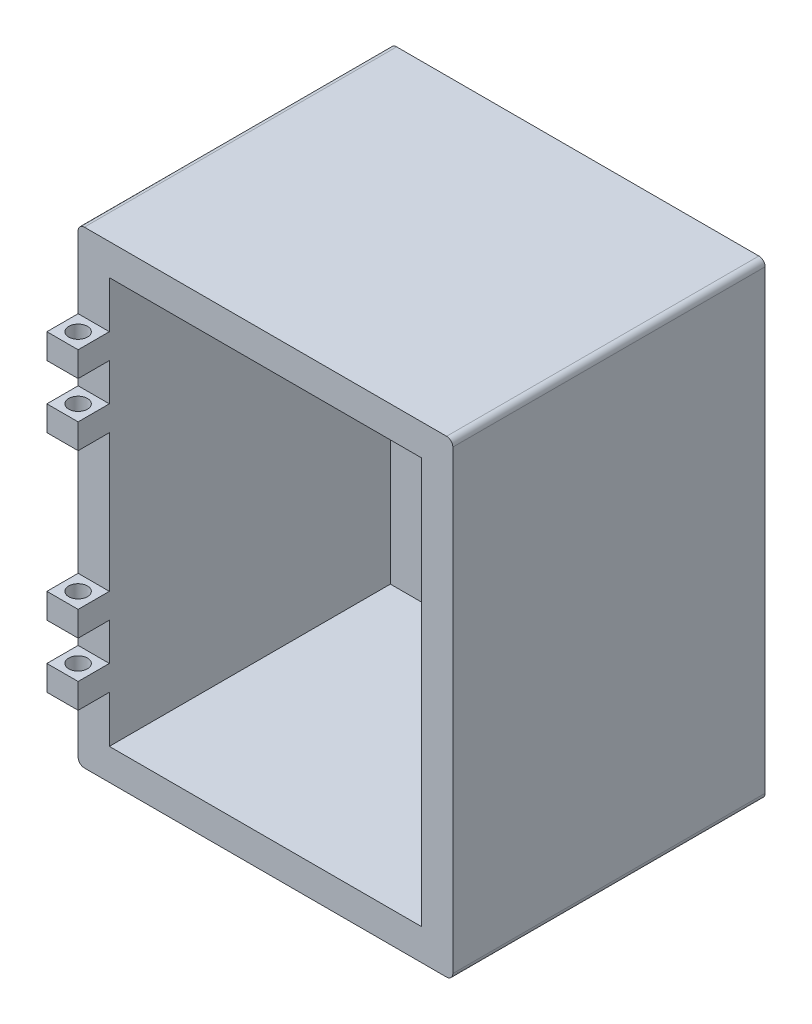
from build123d import *

# Parameters (mm, degrees)
SKETCH1_W           = 120
SKETCH1_H           = 150
BOSS_EXTRUDE1_DEPTH = 100
SHELL1_T            = -10
SKETCH2_W           = 10
SKETCH2_H           = 8
BOSS_EXTRUDE2_DEPTH = 10
SKETCH3_R           = 3
CUT_EXTRUDE1_DEPTH  = 206.243757518
FILLET1_R           = 2


with BuildPart() as part:
    # Sketch1 → Boss-Extrude1 (new body)
    with BuildSketch(Plane.XY):
        with Locations((60, 75)):
            Rectangle(SKETCH1_W, SKETCH1_H)
    extrude(amount=BOSS_EXTRUDE1_DEPTH)

    # Shell1
    shell1_openings = [part.faces().sort_by_distance(p)[0] for p in [
        (60, 75, 100),
    ]]
    offset(amount=SHELL1_T, openings=shell1_openings, kind=Kind.INTERSECTION)

    # Sketch2 → Boss-Extrude2 (add)
    with BuildSketch(Plane.XY.offset(100)):
        with Locations((5, 101)):
            Rectangle(SKETCH2_W, SKETCH2_H)
        with Locations((5, 121)):
            Rectangle(SKETCH2_W, SKETCH2_H)
        with Locations((5, 29)):
            Rectangle(SKETCH2_W, SKETCH2_H)
        with Locations((5, 49)):
            Rectangle(SKETCH2_W, SKETCH2_H)
    extrude(amount=BOSS_EXTRUDE2_DEPTH)

    # Sketch3 → Cut-Extrude1 (cut, through all)
    with BuildSketch(Plane(origin=(0, 125, 0), x_dir=(1, 0, 0), z_dir=(0, 1, 0))):
        with Locations(Location((5, -105, 0), (0, 0, 270))):
            Circle(SKETCH3_R)
    extrude(amount=-CUT_EXTRUDE1_DEPTH, mode=Mode.SUBTRACT)

    # Fillet1
    fillet1_edges = [part.edges().sort_by_distance(p)[0] for p in [
        (0, 150, 50),
        (120, 150, 50),
        (120, 0, 50),
        (0, 0, 50),
    ]]
    fillet(fillet1_edges, radius=FILLET1_R)


solid = part.part
